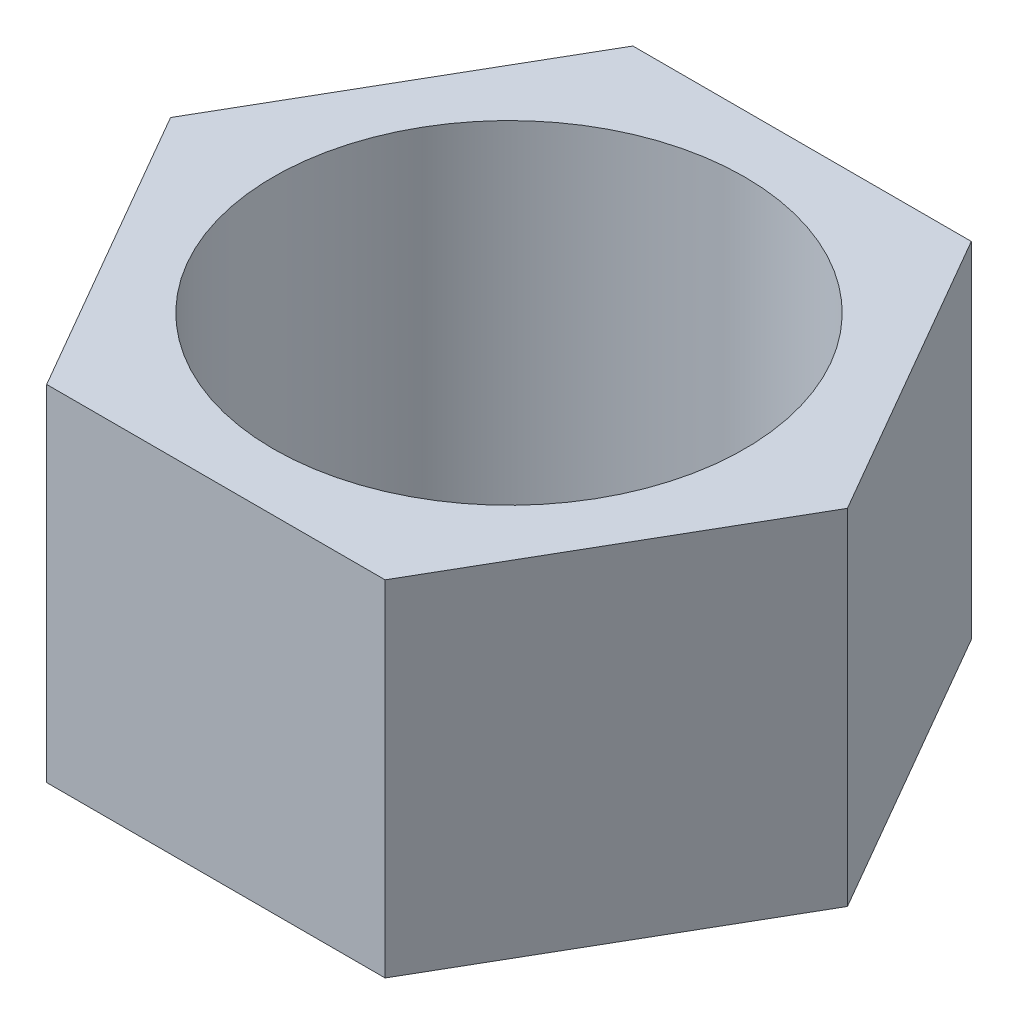
from build123d import *

# Parameters (mm, degrees)
SKETCH1_R           = 5.207
BOSS_EXTRUDE1_DEPTH = 7.62


with BuildPart() as part:
    # Sketch1 → Boss-Extrude1 (new body)
    with BuildSketch(Plane(origin=(0, 0, 0), x_dir=(1, 0, 0), z_dir=(0, 1, 0))):
        Polygon((7.478995387, 0), (3.739497694, 6.477), (-3.739497694, 6.477), (-7.478995387, 0), (-3.739497694, -6.477), (3.739497694, -6.477), align=None)
        with Locations(Location((0, 0, 0), (0, 0, 90))):
            Circle(SKETCH1_R, mode=Mode.SUBTRACT)
    extrude(amount=BOSS_EXTRUDE1_DEPTH)


solid = part.part
